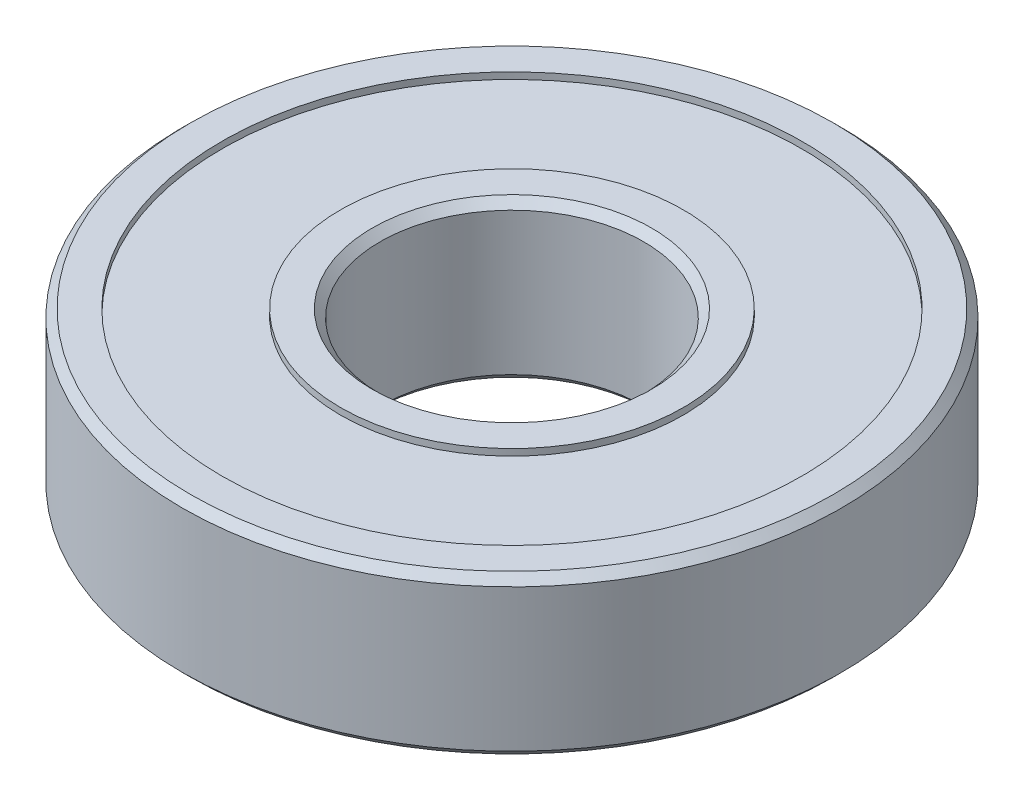
from build123d import *

# Parameters (mm, degrees)
SKETCH1_R           = 11
SKETCH1_R_2         = 6.5
BOSS_EXTRUDE1_DEPTH = 2.75
SKETCH1_3_R         = 12.5
SKETCH1_3_R_2       = 11
SKETCH1_3_R_3       = 6.5
SKETCH1_3_R_4       = 5
BOSS_EXTRUDE2_DEPTH = 3
CHAMFER1_SIZE       = 0.3


with BuildPart() as part:
    # Sketch1 → Boss-Extrude1 (new, symmetric)
    with BuildSketch(Plane(origin=(0, 0, 0), x_dir=(1, 0, 0), z_dir=(0, 1, 0))):
        Circle(SKETCH1_R)
        Circle(SKETCH1_R_2, mode=Mode.SUBTRACT)
    extrude(amount=BOSS_EXTRUDE1_DEPTH, both=True)

    # Sketch1<3> → Boss-Extrude2 (add, symmetric)
    # profile 1 of 2: a face of its own
    with BuildSketch(Plane(origin=(0, 0, 0), x_dir=(1, 0, 0), z_dir=(0, 1, 0))):
        Circle(SKETCH1_3_R)
        Circle(SKETCH1_3_R_2, mode=Mode.SUBTRACT)
    # profile 2 of 2: a face of its own
    with BuildSketch(Plane(origin=(0, 0, 0), x_dir=(1, 0, 0), z_dir=(0, 1, 0))):
        Circle(SKETCH1_3_R_3)
        Circle(SKETCH1_3_R_4, mode=Mode.SUBTRACT)
    extrude(amount=BOSS_EXTRUDE2_DEPTH, both=True)

    # Chamfer1
    chamfer1_edges = [part.edges().sort_by_distance(p)[0] for p in [
        (-5, -3, 0),
        (-5, 3, 0),
        (-12.5, -3, 0),
        (-12.5, 3, 0),
    ]]
    chamfer(chamfer1_edges, length=CHAMFER1_SIZE)


solid = part.part
